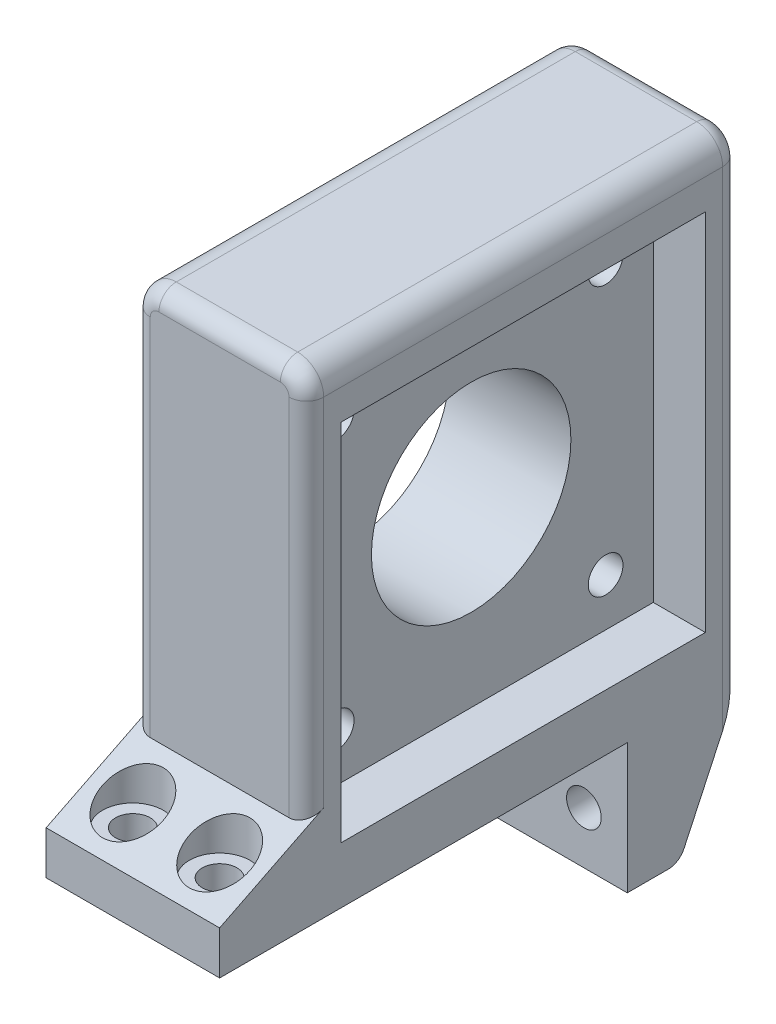
from build123d import *

# Parameters (mm, degrees)
SKETCH1_W           = 20
SKETCH1_H           = 50
BOSS_EXTRUDE1_DEPTH = 70
SKETCH2_R           = 2
SKETCH2_R_2         = 11.5
CUT_EXTRUDE2_DEPTH  = 60
SKETCH4_W           = 37
SKETCH4_H           = 15
CUT_EXTRUDE3_DEPTH  = 60
SKETCH8_R           = 2
CUT_EXTRUDE5_DEPTH  = 15
SKETCH9_W           = 42
SKETCH9_H           = 42
CUT_EXTRUDE6_DEPTH  = 6
CUT_EXTRUDE8_DEPTH  = 30
SKETCH12_W          = 20
SKETCH12_H          = 5
BOSS_EXTRUDE2_DEPTH = 10
BOSS_EXTRUDE3_DEPTH = 20
SKETCH15_R          = 2
CUT_EXTRUDE9_DEPTH  = 10
SKETCH17_R          = 3.5
CUT_EXTRUDE11_DEPTH = 8
SKETCH18_R          = 3.5
CUT_EXTRUDE12_DEPTH = 50
FILLET2_R           = 3
FILLET3_R           = 3
FILLET4_R           = 2
FILLET5_R           = 2
FILLET6_R           = 2


with BuildPart() as part:
    # Sketch1 → Boss-Extrude1 (new body)
    with BuildSketch(Plane(origin=(0, 0, 0), x_dir=(1, 0, 0), z_dir=(0, 1, 0))):
        with Locations((-10, -25)):
            Rectangle(SKETCH1_W, SKETCH1_H)
    extrude(amount=BOSS_EXTRUDE1_DEPTH)

    # Sketch2 → Cut-Extrude2 (cut)
    with BuildSketch(Plane(origin=(0, 0, 0), x_dir=(0, 0, -1), z_dir=(1, 0, 0))):
        with Locations((-9.5, 58)):
            Circle(SKETCH2_R)
        with Locations((-25, 42.5)):
            Circle(SKETCH2_R_2)
        with Locations((-9.5, 27)):
            Circle(SKETCH2_R)
        with Locations((-40.5, 27)):
            Circle(SKETCH2_R)
        with Locations((-40.5, 58)):
            Circle(SKETCH2_R)
    extrude(amount=-CUT_EXTRUDE2_DEPTH, mode=Mode.SUBTRACT)

    # Sketch4 → Cut-Extrude3 (cut)
    with BuildSketch(Plane(origin=(0, 0, 0), x_dir=(0, 0, -1), z_dir=(1, 0, 0))):
        with Locations((-31.5, 7.5)):
            Rectangle(SKETCH4_W, SKETCH4_H)
    extrude(amount=-CUT_EXTRUDE3_DEPTH, mode=Mode.SUBTRACT)

    # Sketch8 → Cut-Extrude5 (cut)
    with BuildSketch(Plane(origin=(0, 0, 0), x_dir=(-1, 0, 0), z_dir=(0, 0, -1))):
        with Locations((15, 6)):
            Circle(SKETCH8_R)
        with Locations((5, 6)):
            Circle(SKETCH8_R)
    extrude(amount=-CUT_EXTRUDE5_DEPTH, mode=Mode.SUBTRACT)

    # Sketch9 → Cut-Extrude6 (cut)
    with BuildSketch(Plane(origin=(0, 0, 0), x_dir=(0, 0, -1), z_dir=(1, 0, 0))):
        with Locations((-25, 42.5)):
            Rectangle(SKETCH9_W, SKETCH9_H)
    extrude(amount=-CUT_EXTRUDE6_DEPTH, mode=Mode.SUBTRACT)

    # Sketch11 → Cut-Extrude8 (cut)
    with BuildSketch(Plane(origin=(0, 0, 0), x_dir=(0, 0, -1), z_dir=(1, 0, 0))):
        Polygon((-7, 0), (0, 0), (0, 15), align=None)
    extrude(amount=-CUT_EXTRUDE8_DEPTH, mode=Mode.SUBTRACT)

    # Sketch12 → Boss-Extrude2 (add)
    with BuildSketch(Plane.XY.offset(50)):
        with Locations((-10, 17.5)):
            Rectangle(SKETCH12_W, SKETCH12_H)
    extrude(amount=BOSS_EXTRUDE2_DEPTH)

    # Sketch14 → Boss-Extrude3 (add)
    with BuildSketch(Plane(origin=(0, 0, 0), x_dir=(0, 0, -1), z_dir=(1, 0, 0))):
        Polygon((-50, 20), (-60, 20), (-50, 25), align=None)
    extrude(amount=-BOSS_EXTRUDE3_DEPTH)

    # Sketch15 → Cut-Extrude9 (cut)
    with BuildSketch(Plane(origin=(0, 15, 0), x_dir=(-1, 0, 0), z_dir=(0, -1, 0))):
        with Locations(Location((5, -55, 0), (0, 0, 90))):
            Circle(SKETCH15_R)
        with Locations(Location((15, -55, 0), (0, 0, 90))):
            Circle(SKETCH15_R)
    extrude(amount=-CUT_EXTRUDE9_DEPTH, mode=Mode.SUBTRACT)

    # Sketch17 → Cut-Extrude11 (cut)
    with BuildSketch(Plane(origin=(0, 0, 0), x_dir=(-1, 0, 0), z_dir=(0, 0, -1))):
        with Locations((15, 6)):
            Circle(SKETCH17_R)
        with Locations((5, 6)):
            Circle(SKETCH17_R)
    extrude(amount=-CUT_EXTRUDE11_DEPTH, mode=Mode.SUBTRACT)

    # Sketch18 → Cut-Extrude12 (cut)
    with BuildSketch(Plane(origin=(0, 70, 0), x_dir=(1, 0, 0), z_dir=(0, 1, 0))):
        with Locations(Location((-15, -55, 0), (0, 0, 270))):
            Circle(SKETCH18_R)
        with Locations(Location((-5, -55, 0), (0, 0, 270))):
            Circle(SKETCH18_R)
    extrude(amount=-CUT_EXTRUDE12_DEPTH, mode=Mode.SUBTRACT)

    # Fillet2
    fillet2_edges = [part.edges().sort_by_distance(p)[0] for p in [
        (0, 70, 25),
    ]]
    fillet(fillet2_edges, radius=FILLET2_R)

    # Fillet3
    fillet3_edges = [part.edges().sort_by_distance(p)[0] for p in [
        (-20, 70, 25),
    ]]
    fillet(fillet3_edges, radius=FILLET3_R)

    # Fillet4
    fillet4_edges = [part.edges().sort_by_distance(p)[0] for p in [
        (0, 46, 50),
        (-0.878679656, 69.121320344, 50),
        (-10, 70, 50),
        (-20, 46, 50),
        (-19.121320344, 69.121320344, 50),
    ]]
    fillet(fillet4_edges, radius=FILLET4_R)

    # Fillet5
    fillet5_edges = [part.edges().sort_by_distance(p)[0] for p in [
        (-10, 70, 0),
        (0, 41, 0),
        (-0.878679656, 69.121320344, 0),
        (-20, 41, 0),
        (-19.121320344, 69.121320344, 0),
    ]]
    fillet(fillet5_edges, radius=FILLET5_R)

    # Fillet6
    fillet6_edges = [part.edges().sort_by_distance(p)[0] for p in [
        (-10, 0, 7),
    ]]
    fillet(fillet6_edges, radius=FILLET6_R)


solid = part.part
